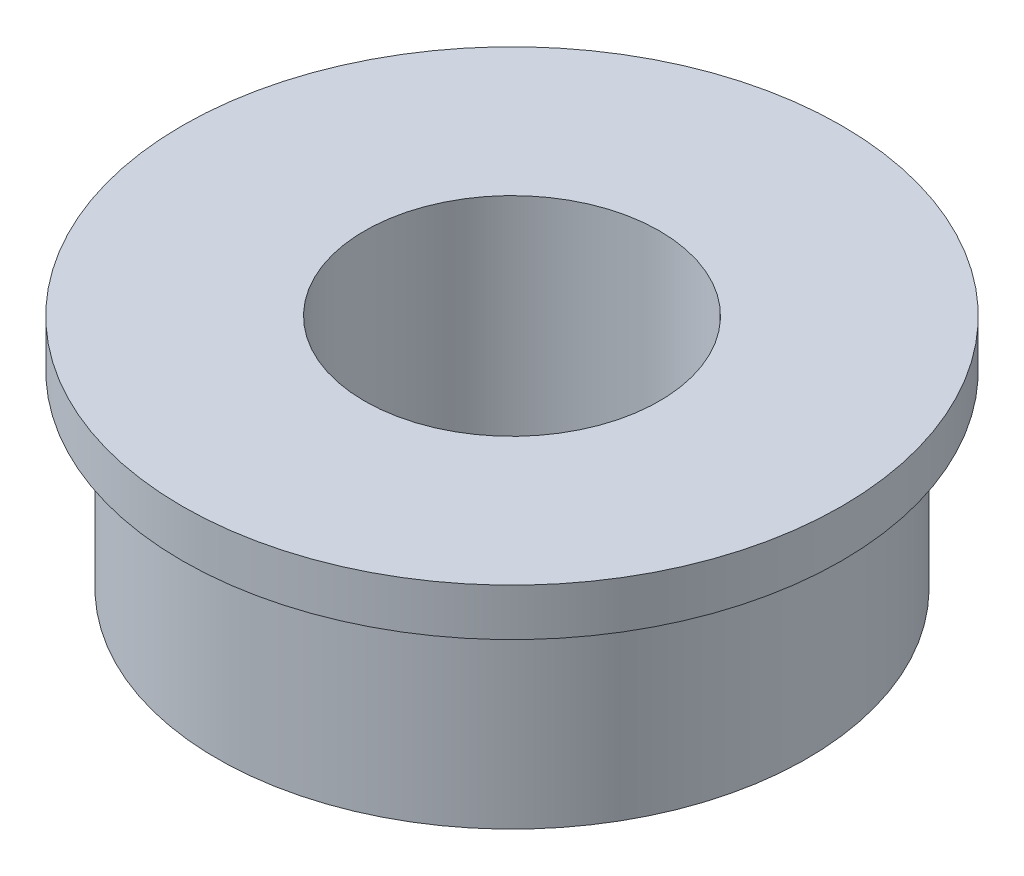
from build123d import *


with BuildPart() as part:
    # Schizzo1 → Rivoluzione1 (revolve)
    with BuildSketch(Plane.XY, mode=Mode.PRIVATE) as rivoluzione1_sk:
        Polygon((2.5, 4), (2.5, 0), (5, 0), (5, 3.2), (5.59, 3.2), (5.59, 4), align=None)
    revolve(rivoluzione1_sk.sketch.rotate(Axis((0, 0, 0), (0, 1, 0)), 90), axis=Axis((0, 0, 0), (0, 1, 0)))


solid = part.part
